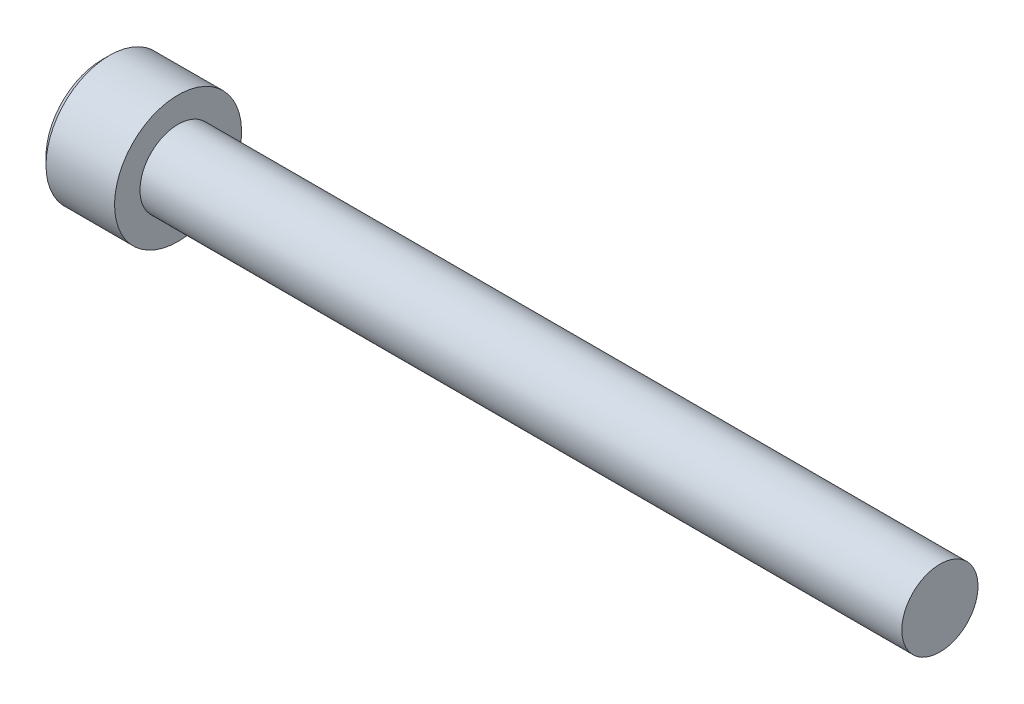
from build123d import *

# Parameters (mm, degrees)
CHAMFER1_SIZE      = 0.6
CUT_EXTRUDE1_DEPTH = 3


with BuildPart() as part:
    # Sketch1 → Revolve1 (revolve)
    with BuildSketch(Plane.XY, mode=Mode.PRIVATE) as revolve1_sk:
        Polygon((-6, 0), (-6, 5), (0, 5), (0, 3), (60, 3), (60, 0), align=None)
    revolve(revolve1_sk.sketch.rotate(Axis((-6, 0, 0), (1, 0, 0)), 180), axis=Axis((-6, 0, 0), (1, 0, 0)))

    # Chamfer1
    chamfer1_edges = [part.edges().sort_by_distance(p)[0] for p in [
        (-6, 5, 0),
    ]]
    chamfer(chamfer1_edges, length=CHAMFER1_SIZE)

    # Sketch2 → Cut-Revolve1 (revolve, cut)
    with BuildSketch(Plane.XY, mode=Mode.PRIVATE) as cut_revolve1_sk:
        Polygon((-1.497848452, 0), (-3, 2.5), (-6, 2.5), (-6, 0), align=None)
    revolve(cut_revolve1_sk.sketch.rotate(Axis((-6, 0, 0), (1, 0, 0)), 180), axis=Axis((-6, 0, 0), (1, 0, 0)), mode=Mode.SUBTRACT)

    # Sketch3 → Cut-Extrude1 (cut)
    with BuildSketch(Plane.ZY.offset(6)):
        Polygon((0, 2.886751346), (-2.5, 1.443375673), (-2.5, -1.443375673), (0, -2.886751346), (2.5, -1.443375673), (2.5, 1.443375673), align=None)
    extrude(amount=-CUT_EXTRUDE1_DEPTH, mode=Mode.SUBTRACT)


solid = part.part
